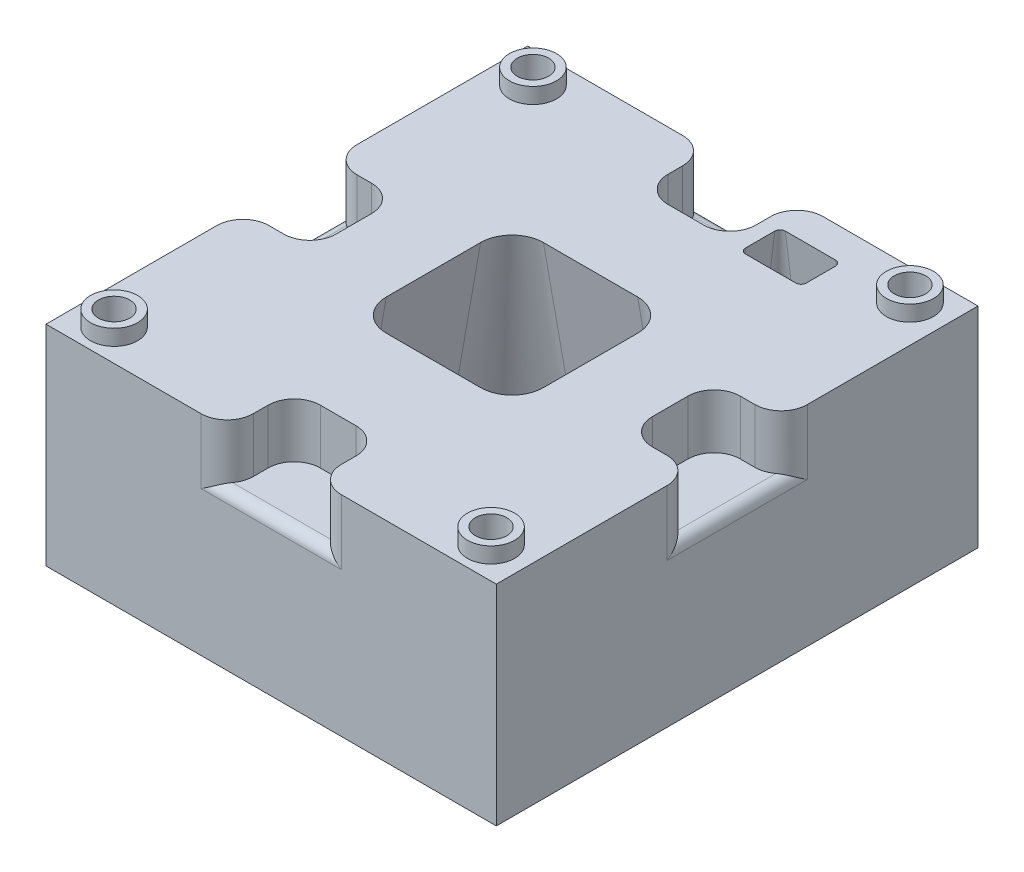
from build123d import *

# Parameters (mm, degrees)
ESQUISSE1_R             = 1.5
BOSS_EXTRU_1_DEPTH      = 20
ESQUISSE2_R             = 2.25
ESQUISSE2_R_2           = 1.5
BOSS_EXTRU_2_DEPTH      = 1.5
ESQUISSE6_W             = 7.215685205
ESQUISSE6_H             = 18.365547593
ESQUISSE6_W_2           = 15.795882497
ESQUISSE6_H_2           = 7.128539117
ESQUISSE6_W_3           = 6.98895005
ESQUISSE6_H_3           = 20.179428837
BOSS_EXTRU_3_DEPTH      = 14.8
ENL_V_MAT_EXTRU_1_DEPTH = 20
ENL_V_MAT_EXTRU_1_DRAFT = 10
ENL_V_MAT_EXTRU_2_DEPTH = 20
ENL_V_MAT_EXTRU_2_DRAFT = 7
ESQUISSE5_R             = 2.5
ENL_V_MAT_EXTRU_3_DEPTH = 18
CONG_4_R                = 1
CONG_5_R                = 1
CONG_6_R                = 1
CONG_7_R                = 1


with BuildPart() as part:
    # Esquisse1 → Boss.-Extru.1 (new body)
    with BuildSketch(Plane(origin=(0, 0, 0), x_dir=(1, 0, 0), z_dir=(0, 1, 0))):
        with BuildLine():
            Line((-19, 4.2), (-17.6, 4.2))
            ThreePointArc((-17.6, 4.2), (-15.832233047, 3.467766953), (-15.1, 1.7))
            Line((-15.1, 1.7), (-15.1, -1.7))
            ThreePointArc((-15.1, -1.7), (-15.832233047, -3.467766953), (-17.6, -4.2))
            Line((-17.6, -4.2), (-19, -4.2))
            ThreePointArc((-19, -4.2), (-20.767766953, -4.932233047), (-21.5, -6.7))
            Line((-21.5, -6.7), (-21.5, -20.5))
            Line((-21.5, -20.5), (-21.5, -23))
            Line((-21.5, -23), (-19, -23))
            Line((-19, -23), (-6.7, -23))
            ThreePointArc((-6.7, -23), (-4.932233047, -22.267766953), (-4.2, -20.5))
            Line((-4.2, -20.5), (-4.2, -19.1))
            ThreePointArc((-4.2, -19.1), (-3.467766953, -17.332233047), (-1.7, -16.6))
            Line((-1.7, -16.6), (1.7, -16.6))
            ThreePointArc((1.7, -16.6), (3.467766953, -17.332233047), (4.2, -19.1))
            Line((4.2, -19.1), (4.2, -20.5))
            ThreePointArc((4.2, -20.5), (4.932233047, -22.267766953), (6.7, -23))
            Line((6.7, -23), (19, -23))
            Line((19, -23), (21.5, -23))
            Line((21.5, -23), (21.5, -20.5))
            Line((21.5, -20.5), (21.5, -6.7))
            ThreePointArc((21.5, -6.7), (20.767766953, -4.932233047), (19, -4.2))
            Line((19, -4.2), (17.6, -4.2))
            ThreePointArc((17.6, -4.2), (15.832233047, -3.467766953), (15.1, -1.7))
            Line((15.1, -1.7), (15.1, 1.7))
            ThreePointArc((15.1, 1.7), (15.832233047, 3.467766953), (17.6, 4.2))
            Line((17.6, 4.2), (19, 4.2))
            ThreePointArc((19, 4.2), (20.767766953, 4.932233047), (21.5, 6.7))
            Line((21.5, 6.7), (21.5, 20.5))
            Line((21.5, 20.5), (21.5, 23))
            Line((21.5, 23), (19, 23))
            Line((19, 23), (6.7, 23))
            ThreePointArc((6.7, 23), (4.932233047, 22.267766953), (4.2, 20.5))
            Line((4.2, 20.5), (4.2, 19.1))
            ThreePointArc((4.2, 19.1), (3.467766953, 17.332233047), (1.7, 16.6))
            Line((1.7, 16.6), (-1.7, 16.6))
            ThreePointArc((-1.7, 16.6), (-3.467766953, 17.332233047), (-4.2, 19.1))
            Line((-4.2, 19.1), (-4.2, 20.5))
            ThreePointArc((-4.2, 20.5), (-4.932233047, 22.267766953), (-6.7, 23))
            Line((-6.7, 23), (-19, 23))
            Line((-19, 23), (-21.5, 23))
            Line((-21.5, 23), (-21.5, 20.5))
            Line((-21.5, 20.5), (-21.5, 6.7))
            ThreePointArc((-21.5, 6.7), (-20.767766953, 4.932233047), (-19, 4.2))
        make_face()
        with Locations(Location((-18, 20, 0), (0, 0, 270))):
            Circle(ESQUISSE1_R, mode=Mode.SUBTRACT)
        with Locations(Location((18, 20, 0), (0, 0, 270))):
            Circle(ESQUISSE1_R, mode=Mode.SUBTRACT)
        with Locations(Location((18, -20, 0), (0, 0, 270))):
            Circle(ESQUISSE1_R, mode=Mode.SUBTRACT)
        with Locations(Location((-18, -20, 0), (0, 0, 270))):
            Circle(ESQUISSE1_R, mode=Mode.SUBTRACT)
    extrude(amount=BOSS_EXTRU_1_DEPTH)

    # Esquisse2 → Boss.-Extru.2 (add)
    # profile 1 of 4: a face of its own
    with BuildSketch(Plane(origin=(0, 20, 0), x_dir=(1, 0, 0), z_dir=(0, 1, 0))):
        with Locations(Location((-18, 20, 0), (0, 0, 270))):
            Circle(ESQUISSE2_R)
        with Locations(Location((-18, 20, 0), (0, 0, 270))):
            Circle(ESQUISSE2_R_2, mode=Mode.SUBTRACT)
    # profile 2 of 4: a face of its own
    with BuildSketch(Plane(origin=(0, 20, 0), x_dir=(1, 0, 0), z_dir=(0, 1, 0))):
        with Locations(Location((18, 20, 0), (0, 0, 270))):
            Circle(ESQUISSE2_R)
        with Locations(Location((18, 20, 0), (0, 0, 270))):
            Circle(ESQUISSE2_R_2, mode=Mode.SUBTRACT)
    # profile 3 of 4: a face of its own
    with BuildSketch(Plane(origin=(0, 20, 0), x_dir=(1, 0, 0), z_dir=(0, 1, 0))):
        with Locations(Location((18, -20, 0), (0, 0, 270))):
            Circle(ESQUISSE2_R)
        with Locations(Location((18, -20, 0), (0, 0, 270))):
            Circle(ESQUISSE2_R_2, mode=Mode.SUBTRACT)
    # profile 4 of 4: a face of its own
    with BuildSketch(Plane(origin=(0, 20, 0), x_dir=(1, 0, 0), z_dir=(0, 1, 0))):
        with Locations(Location((-18, -20, 0), (0, 0, 270))):
            Circle(ESQUISSE2_R)
        with Locations(Location((-18, -20, 0), (0, 0, 270))):
            Circle(ESQUISSE2_R_2, mode=Mode.SUBTRACT)
    extrude(amount=BOSS_EXTRU_2_DEPTH)

    # Esquisse6 → Boss.-Extru.3 (add)
    with BuildSketch(Plane.XZ):
        with Locations((-17.892157398, 0.340102734)):
            Rectangle(ESQUISSE6_W, ESQUISSE6_H)
        with Locations((-0.491259504, 19.435730441)):
            Rectangle(ESQUISSE6_W_2, ESQUISSE6_H_2)
        with Locations((18.005524975, 1.247043355)):
            Rectangle(ESQUISSE6_W_3, ESQUISSE6_H_3)
        with BuildLine():
            Line((-4.2, -19.1), (-4.2, -20.5))
            ThreePointArc((-4.2, -20.5), (-4.932233047, -22.267766953), (-6.7, -23))
            Line((-6.7, -23), (8.691514293, -23))
            Line((8.691514293, -23), (8.691514293, -16.6))
            Line((8.691514293, -16.6), (-1.7, -16.6))
            ThreePointArc((-1.7, -16.6), (-3.467766953, -17.332233047), (-4.2, -19.1))
        make_face()
    extrude(amount=-BOSS_EXTRU_3_DEPTH)


with BuildPart() as enl_v_mat_extru_1_tool:
    # Esquisse3 → Enlèv. mat.-Extru.1 (with draft: the straight prism first)
    with BuildSketch(Plane(origin=(0, 20, 0), x_dir=(1, 0, 0), z_dir=(0, 1, 0))):
        with BuildLine():
            ThreePointArc((-4.5, 7.5), (-6.621320344, 6.621320344), (-7.5, 4.5))
            Line((-7.5, 4.5), (-7.5, -4.5))
            ThreePointArc((-7.5, -4.5), (-6.621320344, -6.621320344), (-4.5, -7.5))
            Line((-4.5, -7.5), (4.5, -7.5))
            ThreePointArc((4.5, -7.5), (6.621320344, -6.621320344), (7.5, -4.5))
            Line((7.5, -4.5), (7.5, 4.5))
            ThreePointArc((7.5, 4.5), (6.621320344, 6.621320344), (4.5, 7.5))
            Line((4.5, 7.5), (-4.5, 7.5))
        make_face()
    extrude(amount=-ENL_V_MAT_EXTRU_1_DEPTH)
    # Enlèv. mat.-Extru.1: the draft: its side faces are tilted about the plane it starts from
    enl_v_mat_extru_1_sides = [enl_v_mat_extru_1_tool.faces().sort_by_distance(p)[0] for p in [
        (-6.621320344, 10, -6.621320344),
        (-7.5, 10, 0),
        (-6.621320344, 10, 6.621320344),
        (0, 10, 7.5),
        (6.621320344, 10, 6.621320344),
        (7.5, 10, 0),
        (6.621320344, 10, -6.621320344),
        (0, 10, -7.5),
    ]]
    draft(enl_v_mat_extru_1_sides, Plane(origin=(0, 20, 0), x_dir=(1, 0, 0), z_dir=(0, 1, 0)), ENL_V_MAT_EXTRU_1_DRAFT)


with BuildPart() as part_1:
    add(part.part)

    # Enlèv. mat.-Extru.1: cut by enl_v_mat_extru_1_tool
    add(enl_v_mat_extru_1_tool.part, mode=Mode.SUBTRACT)


with BuildPart() as enl_v_mat_extru_2_tool:
    # Esquisse4 → Enlèv. mat.-Extru.2 (with draft: the straight prism first)
    with BuildSketch(Plane(origin=(0, 20, 0), x_dir=(1, 0, 0), z_dir=(0, 1, 0))):
        with BuildLine():
            ThreePointArc((6.1, 20), (5.746446609, 19.853553391), (5.6, 19.5))
            Line((5.6, 19.5), (5.6, 16.7))
            ThreePointArc((5.6, 16.7), (5.746446609, 16.346446609), (6.1, 16.2))
            Line((6.1, 16.2), (10.9, 16.2))
            ThreePointArc((10.9, 16.2), (11.253553391, 16.346446609), (11.4, 16.7))
            Line((11.4, 16.7), (11.4, 19.5))
            ThreePointArc((11.4, 19.5), (11.253553391, 19.853553391), (10.9, 20))
            Line((10.9, 20), (6.1, 20))
        make_face()
    extrude(amount=-ENL_V_MAT_EXTRU_2_DEPTH)
    # Enlèv. mat.-Extru.2: the draft: its side faces are tilted about the plane it starts from
    enl_v_mat_extru_2_sides = [enl_v_mat_extru_2_tool.faces().sort_by_distance(p)[0] for p in [
        (11.253553391, 10, -19.853553391),
        (8.5, 10, -20),
        (5.746446609, 10, -19.853553391),
        (5.6, 10, -18.1),
        (5.746446609, 10, -16.346446609),
        (8.5, 10, -16.2),
        (11.253553391, 10, -16.346446609),
        (11.4, 10, -18.1),
    ]]
    draft(enl_v_mat_extru_2_sides, Plane(origin=(0, 20, 0), x_dir=(1, 0, 0), z_dir=(0, 1, 0)), ENL_V_MAT_EXTRU_2_DRAFT)


with BuildPart() as part_2:
    add(part_1.part)

    # Enlèv. mat.-Extru.2: cut by enl_v_mat_extru_2_tool
    add(enl_v_mat_extru_2_tool.part, mode=Mode.SUBTRACT)

    # Esquisse5 → Enlèv. mat.-Extru.3 (cut)
    with BuildSketch(Plane.XZ):
        with Locations(Location((-18, 20, 0), (0, 0, 270))):
            Circle(ESQUISSE5_R)
        with Locations(Location((18, 20, 0), (0, 0, 270))):
            Circle(ESQUISSE5_R)
        with Locations(Location((18, -20, 0), (0, 0, 270))):
            Circle(ESQUISSE5_R)
        with Locations(Location((-18, -20, 0), (0, 0, 270))):
            Circle(ESQUISSE5_R)
    extrude(amount=-ENL_V_MAT_EXTRU_3_DEPTH, mode=Mode.SUBTRACT)

    # Congé4
    cong_4_edges = [part_2.edges().sort_by_distance(p)[0] for p in [
        (-21.5, 14.8, 0),
    ]]
    fillet(cong_4_edges, radius=CONG_4_R)

    # Congé5
    cong_5_edges = [part_2.edges().sort_by_distance(p)[0] for p in [
        (0, 14.8, 23),
    ]]
    fillet(cong_5_edges, radius=CONG_5_R)

    # Congé6
    cong_6_edges = [part_2.edges().sort_by_distance(p)[0] for p in [
        (21.5, 14.8, 0),
    ]]
    fillet(cong_6_edges, radius=CONG_6_R)

    # Congé7
    cong_7_edges = [part_2.edges().sort_by_distance(p)[0] for p in [
        (0, 14.8, -23),
    ]]
    fillet(cong_7_edges, radius=CONG_7_R)


solid = part_2.part
